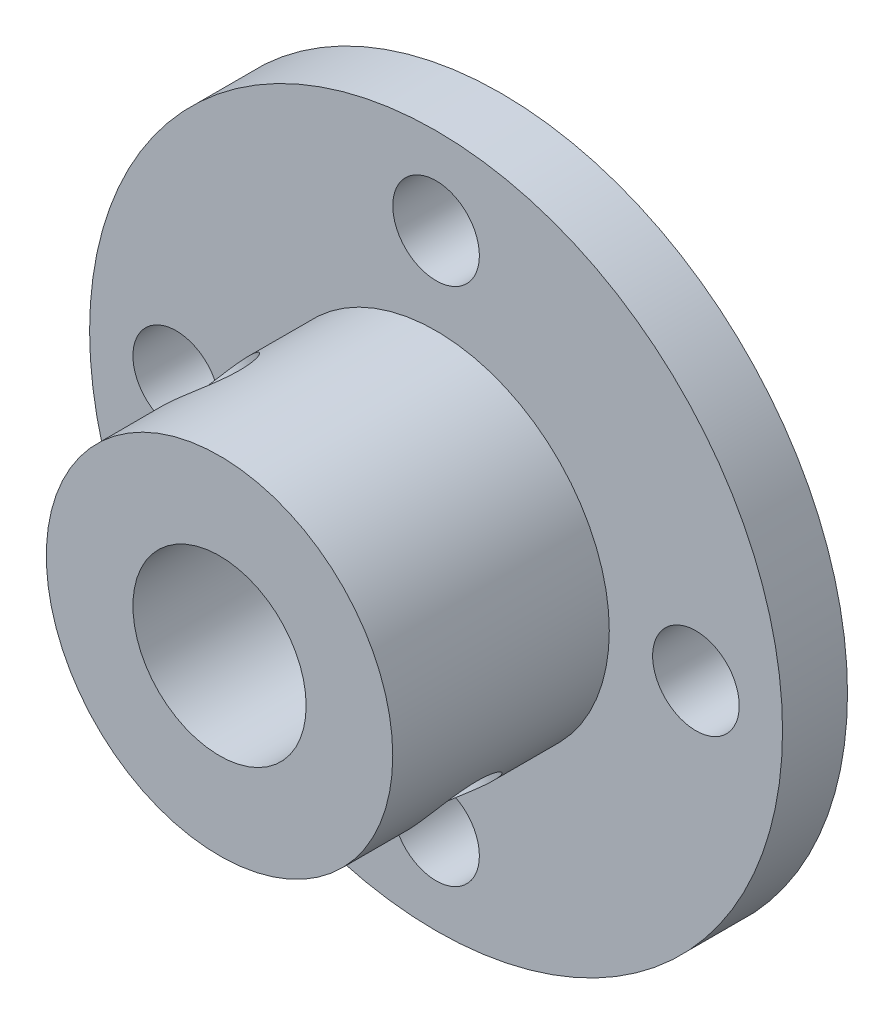
from build123d import *

# Parameters (mm, degrees)
SKETCH1_R                           = 16
BOSS_EXTRUDE1_DEPTH                 = 3
SKETCH2_R                           = 8
BOSS_EXTRUDE2_DEPTH                 = 10
SKETCH3_R                           = 4
CUT_EXTRUDE1_DEPTH                  = 13
SKETCH4_R                           = 2
CUT_EXTRUDE2_DEPTH                  = 3
CUT_EXTRUDE3_REACH                  = 28.096
CUT_EXTRUDE3_END_RADIUS             = 8
SKETCH5_R                           = 2
CUT_EXTRUDE3_DIRECTION_2_REACH      = 28.096
CUT_EXTRUDE3_DIRECTION_2_END_RADIUS = 8


with BuildPart() as part:
    # Sketch1 → Boss-Extrude1 (new body)
    with BuildSketch(Plane.XY):
        Circle(SKETCH1_R)
    extrude(amount=BOSS_EXTRUDE1_DEPTH)

    # Sketch2 → Boss-Extrude2 (add)
    with BuildSketch(Plane.XY.offset(3)):
        Circle(SKETCH2_R)
    extrude(amount=BOSS_EXTRUDE2_DEPTH)

    # Sketch3 → Cut-Extrude1 (cut)
    with BuildSketch(Plane.XY.offset(13)):
        Circle(SKETCH3_R)
    extrude(amount=-CUT_EXTRUDE1_DEPTH, mode=Mode.SUBTRACT)

    # Sketch4 → Cut-Extrude2 (cut)
    with BuildSketch(Plane.XY.offset(3)):
        with Locations((-12, 0)):
            Circle(SKETCH4_R)
        with Locations((0, 12)):
            Circle(SKETCH4_R)
        with Locations((12, 0)):
            Circle(SKETCH4_R)
        with Locations((0, -12)):
            Circle(SKETCH4_R)
    extrude(amount=-CUT_EXTRUDE2_DEPTH, mode=Mode.SUBTRACT)

    # Cut-Extrude3: up to this cylinder (the profile starts inside it)
    cut_extrude3_end = Plane(origin=(0, 0, 8), z_dir=(0, 0, -1)) * Cylinder(CUT_EXTRUDE3_END_RADIUS, 73.192, mode=Mode.PRIVATE)
    # Sketch5 → Cut-Extrude3 (cut, up to the surface)
    with BuildSketch(Plane(origin=(0, 0, 0), x_dir=(0, 0, -1), z_dir=(0.7071067811865488, -0.7071067811865462, 0)), mode=Mode.PRIVATE) as cut_extrude3_sk1:
        with Locations(Location((-8, 0, 0), (0, 0, 90))):
            Circle(SKETCH5_R)
    cut_extrude3_tool1 = extrude(cut_extrude3_sk1.sketch, amount=-CUT_EXTRUDE3_REACH, mode=Mode.PRIVATE) & cut_extrude3_end
    add(cut_extrude3_tool1.solids().sort_by_distance((0, 0, 8))[0], mode=Mode.SUBTRACT)

    # Cut-Extrude3 direction 2: up to this cylinder (the profile starts inside it)
    cut_extrude3_direction_2_end = Plane(origin=(0, 0, 8), z_dir=(0, 0, -1)) * Cylinder(CUT_EXTRUDE3_DIRECTION_2_END_RADIUS, 73.192, mode=Mode.PRIVATE)
    # Sketch5 → Cut-Extrude3 direction 2 (cut, up to the surface)
    with BuildSketch(Plane(origin=(0, 0, 0), x_dir=(0, 0, -1), z_dir=(0.7071067811865488, -0.7071067811865462, 0)), mode=Mode.PRIVATE) as cut_extrude3_direction_2_sk1:
        with Locations(Location((-8, 0, 0), (0, 0, 90))):
            Circle(SKETCH5_R)
    cut_extrude3_direction_2_tool1 = extrude(cut_extrude3_direction_2_sk1.sketch, amount=CUT_EXTRUDE3_DIRECTION_2_REACH, mode=Mode.PRIVATE) & cut_extrude3_direction_2_end
    add(cut_extrude3_direction_2_tool1.solids().sort_by_distance((0, 0, 8))[0], mode=Mode.SUBTRACT)


solid = part.part
